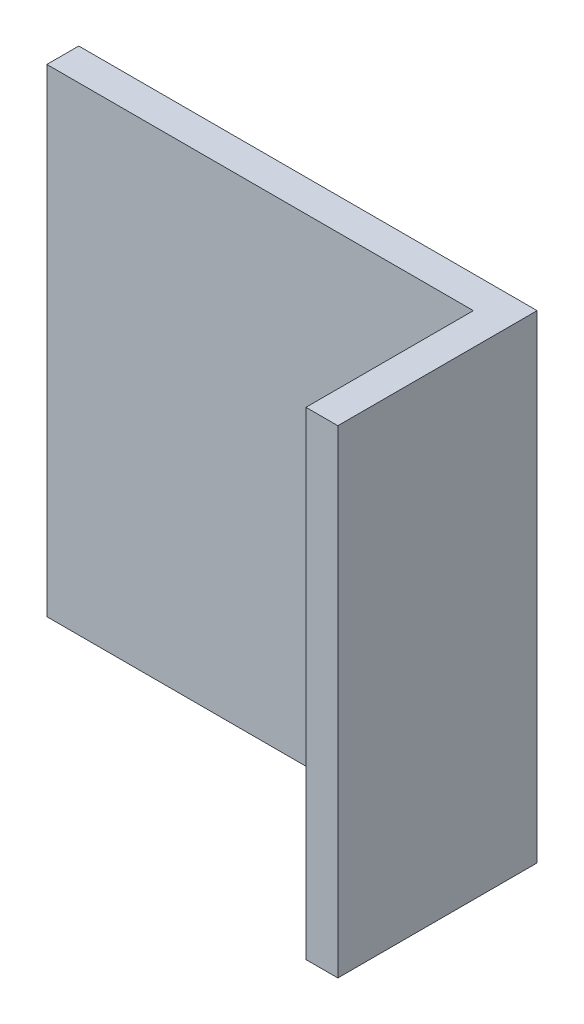
from build123d import *

# Parameters (mm, degrees)
SKETCH_1_W             = 230
SKETCH_1_H             = 240
EXTRUDE_1_DEPTH        = 16
SKETCH_3_R             = 13
CUT_EXTRUDE_1_DEPTH    = 167.976046186
PATTERN_LINEAR_1_COUNT = 3
PATTERN_LINEAR_1_PITCH = 80
SKETCH_4_W             = 16
SKETCH_4_H             = 240
EXTRUDE_2_DEPTH        = 84
SKETCH_5_R             = 13
CUT_EXTRUDE_2_DEPTH    = 265.945277369
PATTERN_LINEAR_2_COUNT = 3
PATTERN_LINEAR_2_PITCH = 80
SKETCH_6_W             = 214
SKETCH_6_H             = 240
EXTRUDE_3_DEPTH        = 16
SKETCH_7_W             = 84
SKETCH_7_H             = 240
EXTRUDE_4_DEPTH        = 16


with BuildPart() as part:
    # 草图1 → 凸台-拉伸1 (new body)
    with BuildSketch(Plane.XY):
        Rectangle(SKETCH_1_W, SKETCH_1_H)
    extrude(amount=EXTRUDE_1_DEPTH)

    # 草图3 → 切除-拉伸1 (cut, through all)
    with BuildSketch(Plane.XY.offset(16)):
        with Locations((-73, 80)):
            Circle(SKETCH_3_R)
        with Locations((-14.5, 80)):
            Circle(SKETCH_3_R)
        with Locations((43.5, 80)):
            Circle(SKETCH_3_R)
    cut_extrude_1 = extrude(amount=-CUT_EXTRUDE_1_DEPTH, mode=Mode.SUBTRACT)

    # 阵列(线性)1: 切除-拉伸1 ×3
    with Locations(*[(0, -i * PATTERN_LINEAR_1_PITCH, 0) for i in range(1, PATTERN_LINEAR_1_COUNT)]):
        add(cut_extrude_1, mode=Mode.SUBTRACT)

    # 草图4 → 凸台-拉伸2 (add)
    with BuildSketch(Plane.XY.offset(16)):
        with Locations((107, 0)):
            Rectangle(SKETCH_4_W, SKETCH_4_H)
    extrude(amount=EXTRUDE_2_DEPTH)

    # 草图5 → 切除-拉伸2 (cut, through all)
    with BuildSketch(Plane.ZY.offset(-99)):
        with Locations((48, 80)):
            Circle(SKETCH_5_R)
    cut_extrude_2 = extrude(amount=-CUT_EXTRUDE_2_DEPTH, mode=Mode.SUBTRACT)

    # 阵列(线性)2: 切除-拉伸2 ×3
    with Locations(*[(0, -i * PATTERN_LINEAR_2_PITCH, 0) for i in range(1, PATTERN_LINEAR_2_COUNT)]):
        add(cut_extrude_2, mode=Mode.SUBTRACT)

    # 草图6 → 凸台-拉伸3 (add)
    with BuildSketch(Plane.XY.offset(16)):
        with Locations((-8, 0)):
            Rectangle(SKETCH_6_W, SKETCH_6_H)
    extrude(amount=-EXTRUDE_3_DEPTH)

    # 草图7 → 凸台-拉伸4 (add)
    with BuildSketch(Plane.ZY.offset(-99)):
        with Locations((58, 0)):
            Rectangle(SKETCH_7_W, SKETCH_7_H)
    extrude(amount=-EXTRUDE_4_DEPTH)


solid = part.part
